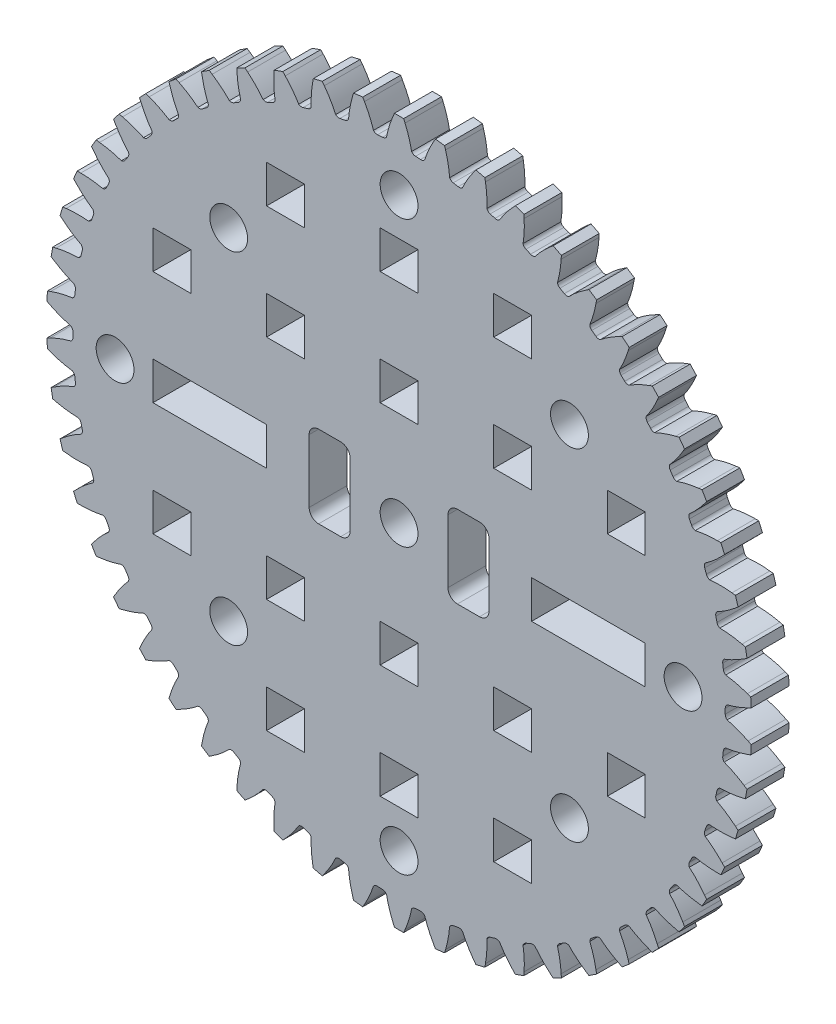
from build123d import *

# Parameters (mm, degrees)
MODEL_R                 = 1.5
MODEL_W                 = 3
MODEL_H                 = 3
MODEL_W_2               = 9
SALIENTE_EXTRUIR1_DEPTH = 3


with BuildPart() as part:
    # Model → Saliente-Extruir1 (new body)
    with BuildSketch(Plane.XY):
        with BuildLine():
            Line((42.666112534, 293.118679828), (42.831818554, 293.341758876))
            Line((42.831818554, 293.341758876), (43.541383546, 293.173588883))
            Line((43.541383546, 293.173588883), (43.58934616, 292.89986944))
            ThreePointArc((43.58934616, 292.89986944), (43.695378697, 292.019957383), (43.707036734, 291.13375638))
            ThreePointArc((43.707036734, 291.13375638), (43.808559511, 290.98396211), (43.967022143, 290.896584814))
            Line((43.967022143, 290.896584814), (44.348377912, 290.782414391))
            ThreePointArc((44.348377912, 290.782414391), (44.528786118, 290.768340418), (44.695920457, 290.837704028))
            ThreePointArc((44.695920457, 290.837704028), (45.192636012, 291.571707968), (45.76474448, 292.248597936))
            Line((45.76474448, 292.248597936), (45.955227951, 292.450931307))
            Line((45.955227951, 292.450931307), (46.640471774, 292.201522952))
            Line((46.640471774, 292.201522952), (46.656333194, 291.924086182))
            ThreePointArc((46.656333194, 291.924086182), (46.659497223, 291.03781415), (46.568194775, 290.156251906))
            ThreePointArc((46.568194775, 290.156251906), (46.651641038, 289.995684416), (46.798888317, 289.890501545))
            Line((46.798888317, 289.890501545), (47.164411118, 289.7328304))
            ThreePointArc((47.164411118, 289.7328304), (47.34196558, 289.697907475), (47.51602244, 289.74739896))
            ThreePointArc((47.51602244, 289.74739896), (48.094592038, 290.418774672), (48.741414242, 291.024670013))
            Line((48.741414242, 291.024670013), (48.954099203, 291.203521497))
            Line((48.954099203, 291.203521497), (49.60575511, 290.8762476))
            Line((49.60575511, 290.8762476), (49.589300838, 290.59884536))
            ThreePointArc((49.589300838, 290.59884536), (49.489553569, 289.71819866), (49.296525346, 288.853196792))
            ThreePointArc((49.296525346, 288.853196792), (49.360766627, 288.684027482), (49.494807287, 288.562461455))
            Line((49.494807287, 288.562461455), (49.83955405, 288.363421818))
            ThreePointArc((49.83955405, 288.363421818), (50.011853649, 288.308122215), (50.190479209, 288.337072288))
            ThreePointArc((50.190479209, 288.337072288), (50.84307869, 288.936740567), (51.555867469, 289.463447586))
            Line((51.555867469, 289.463447586), (51.78787772, 289.616398524))
            Line((51.78787772, 289.616398524), (52.397133183, 289.215684902))
            Line((52.397133183, 289.215684902), (52.348585734, 288.942068581))
            ThreePointArc((52.348585734, 288.942068581), (52.147276079, 288.07895645), (51.855132456, 287.242212624))
            ThreePointArc((51.855132456, 287.242212624), (51.899300002, 287.066729219), (52.018321373, 286.930424007))
            Line((52.018321373, 286.930424007), (52.337629991, 286.692707549))
            ThreePointArc((52.337629991, 286.692707549), (52.502344669, 286.617779099), (52.683123325, 286.625796261))
            ThreePointArc((52.683123325, 286.625796261), (53.4009274, 287.145647622), (54.170043509, 287.586043509))
            Line((54.170043509, 287.586043509), (54.41824151, 287.711025502))
            Line((54.41824151, 287.711025502), (54.976857393, 287.24229112))
            Line((54.976857393, 287.24229112), (54.896873289, 286.97616091))
            ThreePointArc((54.896873289, 286.97616091), (54.596723615, 286.142255459), (54.209415334, 285.3450852))
            ThreePointArc((54.209415334, 285.3450852), (54.232911855, 285.165660812), (54.335304377, 285.016459709))
            Line((54.335304377, 285.016459709), (54.624856747, 284.743281136))
            ThreePointArc((54.624856747, 284.743281136), (54.779759021, 284.649737119), (54.960246053, 284.63671295))
            ThreePointArc((54.960246053, 284.63671295), (55.733547653, 285.069717296), (56.548590116, 285.417846453))
            Line((56.548590116, 285.417846453), (56.809619414, 285.513169333))
            Line((56.809619414, 285.513169333), (57.310041396, 284.98275302))
            Line((57.310041396, 284.98275302), (57.199702284, 284.727707874))
            ThreePointArc((57.199702284, 284.727707874), (56.804771601, 283.934286244), (56.327536341, 283.187469912))
            ThreePointArc((56.327536341, 283.187469912), (56.330044088, 283.006530948), (56.414423077, 282.846451643))
            Line((56.414423077, 282.846451643), (56.670303501, 282.541505228))
            ThreePointArc((56.670303501, 282.541505228), (56.813298584, 282.430610666), (56.991053213, 282.396721296))
            ThreePointArc((56.991053213, 282.396721296), (57.80939476, 282.737022985), (58.659341526, 282.988177563))
            Line((58.659341526, 282.988177563), (58.929672149, 283.052552252))
            Line((58.929672149, 283.052552252), (59.365132881, 282.467626978))
            Line((59.365132881, 282.467626978), (59.225930908, 282.227115945))
            ThreePointArc((59.225930908, 282.227115945), (58.741559977, 281.484907802), (58.180851526, 280.798544807))
            ThreePointArc((58.180851526, 280.798544807), (58.162336585, 280.618538156), (58.22756096, 280.449745447))
            Line((58.22756096, 280.449745447), (58.446309095, 280.117155067))
            ThreePointArc((58.446309095, 280.117155067), (58.575463223, 279.990409618), (58.748081624, 279.936113343))
            ThreePointArc((58.748081624, 279.936113343), (59.600396452, 280.179110379), (60.473753449, 280.329893942))
            Line((60.473753449, 280.329893942), (60.749729638, 280.362449883))
            Line((60.749729638, 280.362449883), (61.114340261, 279.730925759))
            Line((61.114340261, 279.730925759), (60.948157896, 279.508201338))
            ThreePointArc((60.948157896, 279.508201338), (60.380897, 278.827243774), (59.74429798, 278.210615998))
            ThreePointArc((59.74429798, 278.210615998), (59.705010733, 278.033975941), (59.750198447, 277.85875246))
            Line((59.750198447, 277.85875246), (59.928856099, 277.503015829))
            ThreePointArc((59.928856099, 277.503015829), (60.042422684, 277.362133508), (60.207570488, 277.288164592))
            ThreePointArc((60.207570488, 277.288164592), (61.082332503, 277.430570857), (61.967289076, 277.478944317))
            Line((61.967289076, 277.478944317), (62.245178727, 277.479241246))
            Line((62.245178727, 277.479241246), (62.534008507, 276.809658552))
            Line((62.534008507, 276.809658552), (62.34309308, 276.60773271))
            ThreePointArc((62.34309308, 276.60773271), (61.700613452, 275.997234508), (60.996732771, 275.458680783))
            ThreePointArc((60.996732771, 275.458680783), (60.937204511, 275.287796074), (60.961744478, 275.108511419))
            Line((60.961744478, 275.108511419), (61.097895608, 274.734439263))
            ThreePointArc((61.097895608, 274.734439263), (61.194338858, 274.581325263), (61.349782725, 274.488684008))
            ThreePointArc((61.349782725, 274.488684008), (62.23516227, 274.528573701), (63.119750899, 274.47388289))
            Line((63.119750899, 274.47388289), (63.39579603, 274.441916791))
            Line((63.39579603, 274.441916791), (63.604939041, 273.743330486))
            Line((63.604939041, 273.743330486), (63.391872356, 273.564933922))
            ThreePointArc((63.391872356, 273.564933922), (62.682862431, 273.033151022), (61.921218868, 272.579954365))
            ThreePointArc((61.921218868, 272.579954365), (61.842254613, 272.417135926), (61.845814971, 272.236214613))
            Line((61.845814971, 272.236214613), (61.937618369, 271.848865619))
            ThreePointArc((61.937618369, 271.848865619), (62.015634054, 271.685590542), (62.159271871, 271.575529763))
            ThreePointArc((62.159271871, 271.575529763), (63.043295708, 271.512363445), (63.915553849, 271.355347962))
            Line((63.915553849, 271.355347962), (64.186021424, 271.291551123))
            Line((64.186021424, 271.291551123), (64.312649365, 270.573408386))
            Line((64.312649365, 270.573408386), (64.080312784, 270.420953608))
            ThreePointArc((64.080312784, 270.420953608), (63.314360703, 269.975077463), (62.505254181, 269.61336658))
            ThreePointArc((62.505254181, 269.61336658), (62.407921787, 269.460816252), (62.390454389, 269.280704932))
            Line((62.390454389, 269.280704932), (62.436668572, 268.885317328))
            ThreePointArc((62.436668572, 268.885317328), (62.495201663, 268.714089191), (62.625090976, 268.588097272))
            ThreePointArc((62.625090976, 268.588097272), (63.495804198, 268.422729158), (64.343936056, 268.165512368))
            Line((64.343936056, 268.165512368), (64.605168466, 268.070747531))
            Line((64.605168466, 268.070747531), (64.647568911, 267.342760012))
            Line((64.647568911, 267.342760012), (64.399104387, 267.21830871))
            ThreePointArc((64.399104387, 267.21830871), (63.586568339, 266.864369028), (62.740940636, 266.599035439))
            ThreePointArc((62.740940636, 266.599035439), (62.626556356, 266.458816203), (62.588297418, 266.281950572))
            Line((62.588297418, 266.281950572), (62.588297418, 265.883871299))
            ThreePointArc((62.588297418, 265.883871299), (62.626556356, 265.707005668), (62.740940636, 265.566786432))
            ThreePointArc((62.740940636, 265.566786432), (63.586568339, 265.301452843), (64.399104387, 264.947513162))
            Line((64.399104387, 264.947513162), (64.647568911, 264.823061859))
            Line((64.647568911, 264.823061859), (64.605168466, 264.09507434))
            Line((64.605168466, 264.09507434), (64.343936056, 264.000309504))
            ThreePointArc((64.343936056, 264.000309504), (63.495804198, 263.743092714), (62.625090976, 263.5777246))
            ThreePointArc((62.625090976, 263.5777246), (62.495201663, 263.45173268), (62.436668572, 263.280504543))
            Line((62.436668572, 263.280504543), (62.390454389, 262.885116939))
            ThreePointArc((62.390454389, 262.885116939), (62.407921787, 262.705005619), (62.505254181, 262.552455291))
            ThreePointArc((62.505254181, 262.552455291), (63.314360703, 262.190744408), (64.080312784, 261.744868263))
            Line((64.080312784, 261.744868263), (64.312649365, 261.592413485))
            Line((64.312649365, 261.592413485), (64.186021424, 260.874270749))
            Line((64.186021424, 260.874270749), (63.915553849, 260.810473909))
            ThreePointArc((63.915553849, 260.810473909), (63.043295708, 260.653458426), (62.159271871, 260.590292108))
            ThreePointArc((62.159271871, 260.590292108), (62.015634054, 260.480231329), (61.937618369, 260.316956253))
            Line((61.937618369, 260.316956253), (61.845814971, 259.929607258))
            ThreePointArc((61.845814971, 259.929607258), (61.842254613, 259.748685945), (61.921218868, 259.585867506))
            ThreePointArc((61.921218868, 259.585867506), (62.682862431, 259.132670849), (63.391872356, 258.600887949))
            Line((63.391872356, 258.600887949), (63.604939041, 258.422491385))
            Line((63.604939041, 258.422491385), (63.39579603, 257.72390508))
            Line((63.39579603, 257.72390508), (63.119750899, 257.691938981))
            ThreePointArc((63.119750899, 257.691938981), (62.23516227, 257.63724817), (61.349782725, 257.677137863))
            ThreePointArc((61.349782725, 257.677137863), (61.194338858, 257.584496609), (61.097895608, 257.431382608))
            Line((61.097895608, 257.431382608), (60.961744478, 257.057310453))
            ThreePointArc((60.961744478, 257.057310453), (60.937204511, 256.878025797), (60.996732771, 256.707141088))
            ThreePointArc((60.996732771, 256.707141088), (61.700613452, 256.168587364), (62.34309308, 255.558089162))
            Line((62.34309308, 255.558089162), (62.534008507, 255.356163319))
            Line((62.534008507, 255.356163319), (62.245178727, 254.686580626))
            Line((62.245178727, 254.686580626), (61.967289076, 254.686877554))
            ThreePointArc((61.967289076, 254.686877554), (61.082332503, 254.735251015), (60.207570488, 254.877657279))
            ThreePointArc((60.207570488, 254.877657279), (60.042422684, 254.803688363), (59.928856099, 254.662806043))
            Line((59.928856099, 254.662806043), (59.750198447, 254.307069411))
            ThreePointArc((59.750198447, 254.307069411), (59.705010733, 254.13184593), (59.74429798, 253.955205873))
            ThreePointArc((59.74429798, 253.955205873), (60.380897, 253.338578097), (60.948157896, 252.657620533))
            Line((60.948157896, 252.657620533), (61.114340261, 252.434896112))
            Line((61.114340261, 252.434896112), (60.749729638, 251.803371989))
            Line((60.749729638, 251.803371989), (60.473753449, 251.835927929))
            ThreePointArc((60.473753449, 251.835927929), (59.600396453, 251.986711493), (58.748081624, 252.229708528))
            ThreePointArc((58.748081624, 252.229708528), (58.575463223, 252.175412254), (58.446309095, 252.048666805))
            Line((58.446309095, 252.048666805), (58.22756096, 251.716076424))
            ThreePointArc((58.22756096, 251.716076424), (58.162336585, 251.547283716), (58.180851526, 251.367277064))
            ThreePointArc((58.180851526, 251.367277064), (58.741559977, 250.680914069), (59.225930908, 249.938705926))
            Line((59.225930908, 249.938705926), (59.365132881, 249.698194893))
            Line((59.365132881, 249.698194893), (58.929672149, 249.11326962))
            Line((58.929672149, 249.11326962), (58.659341526, 249.177644308))
            ThreePointArc((58.659341526, 249.177644308), (57.80939476, 249.428798886), (56.991053213, 249.769100575))
            ThreePointArc((56.991053213, 249.769100575), (56.813298584, 249.735211206), (56.670303501, 249.624316643))
            Line((56.670303501, 249.624316643), (56.414423077, 249.319370228))
            ThreePointArc((56.414423077, 249.319370228), (56.330044088, 249.159290924), (56.327536341, 248.978351959))
            ThreePointArc((56.327536341, 248.978351959), (56.804771601, 248.231535627), (57.199702284, 247.438113997))
            Line((57.199702284, 247.438113997), (57.310041396, 247.183068851))
            Line((57.310041396, 247.183068851), (56.809619414, 246.652652538))
            Line((56.809619414, 246.652652538), (56.548590116, 246.747975418))
            ThreePointArc((56.548590116, 246.747975418), (55.733547653, 247.096104575), (54.960246053, 247.529108921))
            ThreePointArc((54.960246053, 247.529108921), (54.779759021, 247.516084752), (54.624856747, 247.422540735))
            Line((54.624856747, 247.422540735), (54.335304377, 247.149362163))
            ThreePointArc((54.335304377, 247.149362163), (54.232911855, 247.00016106), (54.209415333, 246.820736671))
            ThreePointArc((54.209415333, 246.820736671), (54.596723615, 246.023566412), (54.896873289, 245.189660962))
            Line((54.896873289, 245.189660962), (54.976857393, 244.923530751))
            Line((54.976857393, 244.923530751), (54.41824151, 244.45479637))
            Line((54.41824151, 244.45479637), (54.170043509, 244.579778362))
            ThreePointArc((54.170043509, 244.579778362), (53.4009274, 245.020174249), (52.683123326, 245.540025611))
            ThreePointArc((52.683123326, 245.540025611), (52.502344669, 245.548042772), (52.337629991, 245.473114323))
            Line((52.337629991, 245.473114323), (52.018321373, 245.235397864))
            ThreePointArc((52.018321373, 245.235397864), (51.899300002, 245.099092652), (51.855132456, 244.923609247))
            ThreePointArc((51.855132456, 244.923609247), (52.147276079, 244.086865421), (52.348585734, 243.22375329))
            Line((52.348585734, 243.22375329), (52.397133183, 242.950136969))
            Line((52.397133183, 242.950136969), (51.78787772, 242.549423348))
            Line((51.78787772, 242.549423348), (51.555867469, 242.702374286))
            ThreePointArc((51.555867469, 242.702374286), (50.84307869, 243.229081304), (50.190479209, 243.828749583))
            ThreePointArc((50.190479209, 243.828749583), (50.011853649, 243.857699656), (49.83955405, 243.802400053))
            Line((49.83955405, 243.802400053), (49.494807287, 243.603360417))
            ThreePointArc((49.494807287, 243.603360417), (49.360766627, 243.481794389), (49.296525346, 243.312625079))
            ThreePointArc((49.296525346, 243.312625079), (49.489553569, 242.447623211), (49.589300838, 241.566976512))
            Line((49.589300838, 241.566976512), (49.60575511, 241.289574271))
            Line((49.60575511, 241.289574271), (48.954099203, 240.962300374))
            Line((48.954099203, 240.962300374), (48.741414242, 241.141151858))
            ThreePointArc((48.741414242, 241.141151858), (48.094592038, 241.747047199), (47.51602244, 242.418422911))
            ThreePointArc((47.51602244, 242.418422911), (47.34196558, 242.467914396), (47.164411118, 242.432991472))
            Line((47.164411118, 242.432991472), (46.798888317, 242.275320326))
            ThreePointArc((46.798888317, 242.275320326), (46.651641038, 242.170137456), (46.568194775, 242.009569966))
            ThreePointArc((46.568194775, 242.009569966), (46.659497223, 241.128007722), (46.656333194, 240.241735689))
            Line((46.656333194, 240.241735689), (46.640471774, 239.964298919))
            Line((46.640471774, 239.964298919), (45.955227951, 239.714890564))
            Line((45.955227951, 239.714890564), (45.76474448, 239.917223936))
            ThreePointArc((45.76474448, 239.917223936), (45.192636012, 240.594113903), (44.695920457, 241.328117844))
            ThreePointArc((44.695920457, 241.328117844), (44.528786118, 241.397481453), (44.348377912, 241.38340748))
            Line((44.348377912, 241.38340748), (43.967022143, 241.269237057))
            ThreePointArc((43.967022143, 241.269237057), (43.808559511, 241.181859762), (43.707036734, 241.032065491))
            ThreePointArc((43.707036734, 241.032065491), (43.695378697, 240.145864489), (43.58934616, 239.265952432))
            Line((43.58934616, 239.265952432), (43.541383546, 238.992232988))
            Line((43.541383546, 238.992232988), (42.831818554, 238.824062996))
            Line((42.831818554, 238.824062996), (42.666112534, 239.047142043))
            ThreePointArc((42.666112534, 239.047142043), (42.176454588, 239.785872862), (41.768310303, 240.572578886))
            ThreePointArc((41.768310303, 240.572578886), (41.61035869, 240.660876597), (41.429536451, 240.667841901))
            Line((41.429536451, 240.667841901), (41.037504896, 240.59871616))
            ThreePointArc((41.037504896, 240.59871616), (40.869969847, 240.530326067), (40.751743477, 240.393330727))
            ThreePointArc((40.751743477, 240.393330727), (40.637282611, 239.514475314), (40.429815473, 238.652822534))
            Line((40.429815473, 238.652822534), (40.350400277, 238.386522003))
            Line((40.350400277, 238.386522003), (39.626109765, 238.301864584))
            Line((39.626109765, 238.301864584), (39.487422087, 238.542672545))
            ThreePointArc((39.487422087, 238.542672545), (39.086836446, 239.333254148), (38.772782881, 240.162023407))
            ThreePointArc((38.772782881, 240.162023407), (38.626150019, 240.268061143), (38.447359058, 240.295971531))
            Line((38.447359058, 240.295971531), (38.049953272, 240.27282528))
            ThreePointArc((38.049953272, 240.27282528), (37.875611429, 240.224347248), (37.742280276, 240.102003465))
            ThreePointArc((37.742280276, 240.102003465), (37.526564467, 239.242378654), (37.220468365, 238.410637526))
            Line((37.220468365, 238.410637526), (37.110674542, 238.155357166))
            Line((37.110674542, 238.155357166), (36.381453297, 238.155357166))
            Line((36.381453297, 238.155357166), (36.271659473, 238.410637526))
            ThreePointArc((36.271659473, 238.410637526), (35.965563371, 239.242378654), (35.749847563, 240.102003466))
            ThreePointArc((35.749847563, 240.102003466), (35.616516409, 240.224347248), (35.442174567, 240.27282528))
            Line((35.442174567, 240.27282528), (35.044768781, 240.295971531))
            ThreePointArc((35.044768781, 240.295971531), (34.865977819, 240.268061143), (34.719344957, 240.162023407))
            ThreePointArc((34.719344957, 240.162023407), (34.405291393, 239.333254148), (34.004705752, 238.542672545))
            Line((34.004705752, 238.542672545), (33.866018074, 238.301864584))
            Line((33.866018074, 238.301864584), (33.141727562, 238.386522003))
            Line((33.141727562, 238.386522003), (33.062312366, 238.652822534))
            ThreePointArc((33.062312366, 238.652822534), (32.854845228, 239.514475314), (32.740384362, 240.393330727))
            ThreePointArc((32.740384362, 240.393330727), (32.622157992, 240.530326067), (32.454622943, 240.59871616))
            Line((32.454622943, 240.59871616), (32.062591388, 240.667841901))
            ThreePointArc((32.062591388, 240.667841901), (31.881769149, 240.660876597), (31.723817536, 240.572578886))
            ThreePointArc((31.723817536, 240.572578886), (31.315673251, 239.785872862), (30.826015305, 239.047142043))
            Line((30.826015305, 239.047142043), (30.660309285, 238.824062996))
            Line((30.660309285, 238.824062996), (29.950744293, 238.992232988))
            Line((29.950744293, 238.992232988), (29.902781679, 239.265952432))
            ThreePointArc((29.902781679, 239.265952432), (29.796749141, 240.145864489), (29.785091105, 241.032065491))
            ThreePointArc((29.785091105, 241.032065491), (29.683568328, 241.181859762), (29.525105696, 241.269237057))
            Line((29.525105696, 241.269237057), (29.143749927, 241.38340748))
            ThreePointArc((29.143749927, 241.38340748), (28.963341721, 241.397481453), (28.796207382, 241.328117844))
            ThreePointArc((28.796207382, 241.328117844), (28.299491827, 240.594113903), (27.727383359, 239.917223936))
            Line((27.727383359, 239.917223936), (27.536899888, 239.714890564))
            Line((27.536899888, 239.714890564), (26.851656065, 239.964298919))
            Line((26.851656065, 239.964298919), (26.835794644, 240.241735689))
            ThreePointArc((26.835794644, 240.241735689), (26.832630616, 241.128007722), (26.923933064, 242.009569966))
            ThreePointArc((26.923933064, 242.009569966), (26.840486801, 242.170137456), (26.693239521, 242.275320326))
            Line((26.693239521, 242.275320326), (26.327716721, 242.432991472))
            ThreePointArc((26.327716721, 242.432991472), (26.150162259, 242.467914396), (25.976105399, 242.418422911))
            ThreePointArc((25.976105399, 242.418422911), (25.397535801, 241.747047199), (24.750713597, 241.141151858))
            Line((24.750713597, 241.141151858), (24.538028636, 240.962300374))
            Line((24.538028636, 240.962300374), (23.886372729, 241.289574271))
            Line((23.886372729, 241.289574271), (23.902827001, 241.566976512))
            ThreePointArc((23.902827001, 241.566976512), (24.00257427, 242.447623211), (24.195602493, 243.312625079))
            ThreePointArc((24.195602493, 243.312625079), (24.131361212, 243.481794389), (23.997320551, 243.603360417))
            Line((23.997320551, 243.603360417), (23.652573788, 243.802400053))
            ThreePointArc((23.652573788, 243.802400053), (23.48027419, 243.857699656), (23.301648629, 243.828749583))
            ThreePointArc((23.301648629, 243.828749583), (22.649049149, 243.229081304), (21.93626037, 242.702374286))
            Line((21.93626037, 242.702374286), (21.704250118, 242.549423348))
            Line((21.704250118, 242.549423348), (21.094994656, 242.950136969))
            Line((21.094994656, 242.950136969), (21.143542105, 243.22375329))
            ThreePointArc((21.143542105, 243.22375329), (21.34485176, 244.086865421), (21.636995383, 244.923609247))
            ThreePointArc((21.636995383, 244.923609247), (21.592827836, 245.099092652), (21.473806465, 245.235397864))
            Line((21.473806465, 245.235397864), (21.154497848, 245.473114323))
            ThreePointArc((21.154497848, 245.473114323), (20.98978317, 245.548042772), (20.809004513, 245.540025611))
            ThreePointArc((20.809004513, 245.540025611), (20.091200439, 245.020174249), (19.32208433, 244.579778362))
            Line((19.32208433, 244.579778362), (19.073886328, 244.45479637))
            Line((19.073886328, 244.45479637), (18.515270446, 244.923530751))
            Line((18.515270446, 244.923530751), (18.59525455, 245.189660962))
            ThreePointArc((18.59525455, 245.189660962), (18.895404223, 246.023566412), (19.282712505, 246.820736671))
            ThreePointArc((19.282712505, 246.820736671), (19.259215984, 247.00016106), (19.156823462, 247.149362163))
            Line((19.156823462, 247.149362163), (18.867271091, 247.422540735))
            ThreePointArc((18.867271091, 247.422540735), (18.712368817, 247.516084752), (18.531881786, 247.529108921))
            ThreePointArc((18.531881786, 247.529108921), (17.758580186, 247.096104575), (16.943537723, 246.747975418))
            Line((16.943537723, 246.747975418), (16.682508424, 246.652652538))
            Line((16.682508424, 246.652652538), (16.182086442, 247.183068851))
            Line((16.182086442, 247.183068851), (16.292425555, 247.438113997))
            ThreePointArc((16.292425555, 247.438113997), (16.687356237, 248.231535627), (17.164591497, 248.978351959))
            ThreePointArc((17.164591497, 248.978351959), (17.162083751, 249.159290924), (17.077704762, 249.319370228))
            Line((17.077704762, 249.319370228), (16.821824337, 249.624316643))
            ThreePointArc((16.821824337, 249.624316643), (16.678829255, 249.735211206), (16.501074625, 249.769100575))
            ThreePointArc((16.501074625, 249.769100575), (15.682733078, 249.428798886), (14.832786312, 249.177644308))
            Line((14.832786312, 249.177644308), (14.562455689, 249.11326962))
            Line((14.562455689, 249.11326962), (14.126994957, 249.698194893))
            Line((14.126994957, 249.698194893), (14.26619693, 249.938705926))
            ThreePointArc((14.26619693, 249.938705926), (14.750567862, 250.680914069), (15.311276312, 251.367277064))
            ThreePointArc((15.311276312, 251.367277064), (15.329791254, 251.547283716), (15.264566878, 251.716076424))
            Line((15.264566878, 251.716076424), (15.045818744, 252.048666805))
            ThreePointArc((15.045818744, 252.048666805), (14.916664616, 252.175412254), (14.744046215, 252.229708528))
            ThreePointArc((14.744046215, 252.229708528), (13.891731386, 251.986711492), (13.018374389, 251.835927929))
            Line((13.018374389, 251.835927929), (12.7423982, 251.803371989))
            Line((12.7423982, 251.803371989), (12.377787578, 252.434896112))
            Line((12.377787578, 252.434896112), (12.543969943, 252.657620533))
            ThreePointArc((12.543969943, 252.657620533), (13.111230838, 253.338578097), (13.747829859, 253.955205873))
            ThreePointArc((13.747829859, 253.955205873), (13.787117106, 254.13184593), (13.741929391, 254.307069411))
            Line((13.741929391, 254.307069411), (13.56327174, 254.662806043))
            ThreePointArc((13.56327174, 254.662806043), (13.449705154, 254.803688363), (13.28455735, 254.877657279))
            ThreePointArc((13.28455735, 254.877657279), (12.409795335, 254.735251015), (11.524838763, 254.686877554))
            Line((11.524838763, 254.686877554), (11.246949112, 254.686580626))
            Line((11.246949112, 254.686580626), (10.958119332, 255.356163319))
            Line((10.958119332, 255.356163319), (11.149034759, 255.558089162))
            ThreePointArc((11.149034759, 255.558089162), (11.791514386, 256.168587364), (12.495395067, 256.707141088))
            ThreePointArc((12.495395067, 256.707141088), (12.554923327, 256.878025797), (12.530383361, 257.057310453))
            Line((12.530383361, 257.057310453), (12.394232231, 257.431382608))
            ThreePointArc((12.394232231, 257.431382608), (12.297788981, 257.584496609), (12.142345114, 257.677137863))
            ThreePointArc((12.142345114, 257.677137863), (11.256965569, 257.63724817), (10.37237694, 257.691938981))
            Line((10.37237694, 257.691938981), (10.096331808, 257.72390508))
            Line((10.096331808, 257.72390508), (9.887188798, 258.422491385))
            Line((9.887188798, 258.422491385), (10.100255482, 258.600887949))
            ThreePointArc((10.100255482, 258.600887949), (10.809265408, 259.132670849), (11.570908971, 259.585867506))
            ThreePointArc((11.570908971, 259.585867506), (11.649873226, 259.748685945), (11.646312868, 259.929607258))
            Line((11.646312868, 259.929607258), (11.55450947, 260.316956253))
            ThreePointArc((11.55450947, 260.316956253), (11.476493785, 260.480231329), (11.332855967, 260.590292108))
            ThreePointArc((11.332855967, 260.590292108), (10.448832131, 260.653458426), (9.57657399, 260.810473909))
            Line((9.57657399, 260.810473909), (9.306106414, 260.874270749))
            Line((9.306106414, 260.874270749), (9.179478474, 261.592413485))
            Line((9.179478474, 261.592413485), (9.411815055, 261.744868263))
            ThreePointArc((9.411815055, 261.744868263), (10.177767135, 262.190744408), (10.986873658, 262.552455291))
            ThreePointArc((10.986873658, 262.552455291), (11.084206052, 262.705005619), (11.10167345, 262.885116939))
            Line((11.10167345, 262.885116939), (11.055459267, 263.280504543))
            ThreePointArc((11.055459267, 263.280504543), (10.996926176, 263.45173268), (10.867036862, 263.5777246))
            ThreePointArc((10.867036862, 263.5777246), (9.996323641, 263.743092714), (9.148191782, 264.000309504))
            Line((9.148191782, 264.000309504), (8.886959372, 264.09507434))
            Line((8.886959372, 264.09507434), (8.844558928, 264.823061859))
            Line((8.844558928, 264.823061859), (9.093023451, 264.947513162))
            ThreePointArc((9.093023451, 264.947513162), (9.905559499, 265.301452843), (10.751187203, 265.566786432))
            ThreePointArc((10.751187203, 265.566786432), (10.865571482, 265.707005668), (10.90383042, 265.883871299))
            Line((10.90383042, 265.883871299), (10.90383042, 266.281950572))
            ThreePointArc((10.90383042, 266.281950572), (10.865571482, 266.458816203), (10.751187203, 266.599035439))
            ThreePointArc((10.751187203, 266.599035439), (9.905559499, 266.864369028), (9.093023451, 267.21830871))
            Line((9.093023451, 267.21830871), (8.844558928, 267.342760012))
            Line((8.844558928, 267.342760012), (8.886959372, 268.070747531))
            Line((8.886959372, 268.070747531), (9.148191782, 268.165512368))
            ThreePointArc((9.148191782, 268.165512368), (9.996323641, 268.422729158), (10.867036862, 268.588097271))
            ThreePointArc((10.867036862, 268.588097271), (10.996926176, 268.714089191), (11.055459267, 268.885317328))
            Line((11.055459267, 268.885317328), (11.10167345, 269.280704932))
            ThreePointArc((11.10167345, 269.280704932), (11.084206052, 269.460816252), (10.986873658, 269.61336658))
            ThreePointArc((10.986873658, 269.61336658), (10.177767135, 269.975077463), (9.411815055, 270.420953608))
            Line((9.411815055, 270.420953608), (9.179478474, 270.573408386))
            Line((9.179478474, 270.573408386), (9.306106414, 271.291551123))
            Line((9.306106414, 271.291551123), (9.57657399, 271.355347962))
            ThreePointArc((9.57657399, 271.355347962), (10.448832131, 271.512363445), (11.332855967, 271.575529763))
            ThreePointArc((11.332855967, 271.575529763), (11.476493785, 271.685590542), (11.55450947, 271.848865619))
            Line((11.55450947, 271.848865619), (11.646312868, 272.236214613))
            ThreePointArc((11.646312868, 272.236214613), (11.649873226, 272.417135926), (11.570908971, 272.579954365))
            ThreePointArc((11.570908971, 272.579954365), (10.809265408, 273.033151022), (10.100255482, 273.564933922))
            Line((10.100255482, 273.564933922), (9.887188798, 273.743330486))
            Line((9.887188798, 273.743330486), (10.096331808, 274.441916791))
            Line((10.096331808, 274.441916791), (10.37237694, 274.47388289))
            ThreePointArc((10.37237694, 274.47388289), (11.256965569, 274.528573701), (12.142345114, 274.488684008))
            ThreePointArc((12.142345114, 274.488684008), (12.297788981, 274.581325263), (12.394232231, 274.734439263))
            Line((12.394232231, 274.734439263), (12.530383361, 275.108511419))
            ThreePointArc((12.530383361, 275.108511419), (12.554923327, 275.287796074), (12.495395067, 275.458680783))
            ThreePointArc((12.495395067, 275.458680783), (11.791514386, 275.997234508), (11.149034759, 276.60773271))
            Line((11.149034759, 276.60773271), (10.958119332, 276.809658552))
            Line((10.958119332, 276.809658552), (11.246949112, 277.479241246))
            Line((11.246949112, 277.479241246), (11.524838763, 277.478944317))
            ThreePointArc((11.524838763, 277.478944317), (12.409795335, 277.430570857), (13.28455735, 277.288164592))
            ThreePointArc((13.28455735, 277.288164592), (13.449705154, 277.362133508), (13.56327174, 277.503015829))
            Line((13.56327174, 277.503015829), (13.741929391, 277.85875246))
            ThreePointArc((13.741929391, 277.85875246), (13.787117106, 278.033975941), (13.747829859, 278.210615998))
            ThreePointArc((13.747829859, 278.210615998), (13.111230838, 278.827243774), (12.543969943, 279.508201338))
            Line((12.543969943, 279.508201338), (12.377787578, 279.730925759))
            Line((12.377787578, 279.730925759), (12.7423982, 280.362449883))
            Line((12.7423982, 280.362449883), (13.018374389, 280.329893942))
            ThreePointArc((13.018374389, 280.329893942), (13.891731386, 280.179110379), (14.744046215, 279.936113343))
            ThreePointArc((14.744046215, 279.936113343), (14.916664616, 279.990409618), (15.045818744, 280.117155067))
            Line((15.045818744, 280.117155067), (15.264566878, 280.449745447))
            ThreePointArc((15.264566878, 280.449745447), (15.329791254, 280.618538156), (15.311276312, 280.798544807))
            ThreePointArc((15.311276312, 280.798544807), (14.750567862, 281.484907802), (14.26619693, 282.227115945))
            Line((14.26619693, 282.227115945), (14.126994957, 282.467626978))
            Line((14.126994957, 282.467626978), (14.562455689, 283.052552252))
            Line((14.562455689, 283.052552252), (14.832786312, 282.988177563))
            ThreePointArc((14.832786312, 282.988177563), (15.682733078, 282.737022985), (16.501074625, 282.396721296))
            ThreePointArc((16.501074625, 282.396721296), (16.678829255, 282.430610666), (16.821824337, 282.541505228))
            Line((16.821824337, 282.541505228), (17.077704762, 282.846451643))
            ThreePointArc((17.077704762, 282.846451643), (17.162083751, 283.006530948), (17.164591497, 283.187469912))
            ThreePointArc((17.164591497, 283.187469912), (16.687356237, 283.934286244), (16.292425555, 284.727707874))
            Line((16.292425555, 284.727707874), (16.182086442, 284.98275302))
            Line((16.182086442, 284.98275302), (16.682508424, 285.513169333))
            Line((16.682508424, 285.513169333), (16.943537723, 285.417846453))
            ThreePointArc((16.943537723, 285.417846453), (17.758580186, 285.069717296), (18.531881785, 284.63671295))
            ThreePointArc((18.531881785, 284.63671295), (18.712368817, 284.649737119), (18.867271091, 284.743281136))
            Line((18.867271091, 284.743281136), (19.156823462, 285.016459709))
            ThreePointArc((19.156823462, 285.016459709), (19.259215984, 285.165660812), (19.282712505, 285.3450852))
            ThreePointArc((19.282712505, 285.3450852), (18.895404224, 286.142255459), (18.59525455, 286.97616091))
            Line((18.59525455, 286.97616091), (18.515270446, 287.24229112))
            Line((18.515270446, 287.24229112), (19.073886328, 287.711025502))
            Line((19.073886328, 287.711025502), (19.32208433, 287.586043509))
            ThreePointArc((19.32208433, 287.586043509), (20.091200439, 287.145647622), (20.809004513, 286.625796261))
            ThreePointArc((20.809004513, 286.625796261), (20.98978317, 286.617779099), (21.154497848, 286.692707549))
            Line((21.154497848, 286.692707549), (21.473806465, 286.930424007))
            ThreePointArc((21.473806465, 286.930424007), (21.592827836, 287.066729219), (21.636995383, 287.242212624))
            ThreePointArc((21.636995383, 287.242212624), (21.34485176, 288.07895645), (21.143542105, 288.942068581))
            Line((21.143542105, 288.942068581), (21.094994656, 289.215684902))
            Line((21.094994656, 289.215684902), (21.704250118, 289.616398524))
            Line((21.704250118, 289.616398524), (21.93626037, 289.463447586))
            ThreePointArc((21.93626037, 289.463447586), (22.649049149, 288.936740567), (23.301648629, 288.337072288))
            ThreePointArc((23.301648629, 288.337072288), (23.48027419, 288.308122215), (23.652573788, 288.363421818))
            Line((23.652573788, 288.363421818), (23.997320551, 288.562461455))
            ThreePointArc((23.997320551, 288.562461455), (24.131361212, 288.684027482), (24.195602493, 288.853196792))
            ThreePointArc((24.195602493, 288.853196792), (24.00257427, 289.71819866), (23.902827001, 290.59884536))
            Line((23.902827001, 290.59884536), (23.886372729, 290.8762476))
            Line((23.886372729, 290.8762476), (24.538028636, 291.203521497))
            Line((24.538028636, 291.203521497), (24.750713597, 291.024670013))
            ThreePointArc((24.750713597, 291.024670013), (25.397535801, 290.418774672), (25.976105399, 289.74739896))
            ThreePointArc((25.976105399, 289.74739896), (26.150162259, 289.697907475), (26.327716721, 289.7328304))
            Line((26.327716721, 289.7328304), (26.693239521, 289.890501545))
            ThreePointArc((26.693239521, 289.890501545), (26.840486801, 289.995684416), (26.923933064, 290.156251906))
            ThreePointArc((26.923933064, 290.156251906), (26.832630616, 291.03781415), (26.835794644, 291.924086182))
            Line((26.835794644, 291.924086182), (26.851656065, 292.201522952))
            Line((26.851656065, 292.201522952), (27.536899888, 292.450931307))
            Line((27.536899888, 292.450931307), (27.727383359, 292.248597936))
            ThreePointArc((27.727383359, 292.248597936), (28.299491827, 291.571707968), (28.796207382, 290.837704028))
            ThreePointArc((28.796207382, 290.837704028), (28.963341721, 290.768340418), (29.143749927, 290.782414391))
            Line((29.143749927, 290.782414391), (29.525105696, 290.896584814))
            ThreePointArc((29.525105696, 290.896584814), (29.683568328, 290.98396211), (29.785091105, 291.13375638))
            ThreePointArc((29.785091105, 291.13375638), (29.796749141, 292.019957383), (29.902781679, 292.89986944))
            Line((29.902781679, 292.89986944), (29.950744293, 293.173588883))
            Line((29.950744293, 293.173588883), (30.660309285, 293.341758876))
            Line((30.660309285, 293.341758876), (30.826015305, 293.118679828))
            ThreePointArc((30.826015305, 293.118679828), (31.315673251, 292.37994901), (31.723817536, 291.593242985))
            ThreePointArc((31.723817536, 291.593242985), (31.881769149, 291.504945275), (32.062591388, 291.497979971))
            Line((32.062591388, 291.497979971), (32.454622943, 291.567105711))
            ThreePointArc((32.454622943, 291.567105711), (32.622157992, 291.635495804), (32.740384362, 291.772491144))
            ThreePointArc((32.740384362, 291.772491144), (32.854845228, 292.651346557), (33.062312366, 293.512999337))
            Line((33.062312366, 293.512999337), (33.141727562, 293.779299868))
            Line((33.141727562, 293.779299868), (33.866018074, 293.863957288))
            Line((33.866018074, 293.863957288), (34.004705752, 293.623149327))
            ThreePointArc((34.004705752, 293.623149327), (34.405291393, 292.832567723), (34.719344957, 292.003798464))
            ThreePointArc((34.719344957, 292.003798464), (34.865977819, 291.897760728), (35.044768781, 291.86985034))
            Line((35.044768781, 291.86985034), (35.442174567, 291.892996591))
            ThreePointArc((35.442174567, 291.892996591), (35.616516409, 291.941474623), (35.749847563, 292.063818406))
            ThreePointArc((35.749847563, 292.063818406), (35.965563371, 292.923443217), (36.271659473, 293.755184345))
            Line((36.271659473, 293.755184345), (36.381453297, 294.010464706))
            Line((36.381453297, 294.010464706), (37.110674542, 294.010464706))
            Line((37.110674542, 294.010464706), (37.220468365, 293.755184345))
            ThreePointArc((37.220468365, 293.755184345), (37.526564467, 292.923443217), (37.742280276, 292.063818406))
            ThreePointArc((37.742280276, 292.063818406), (37.875611429, 291.941474623), (38.049953272, 291.892996591))
            Line((38.049953272, 291.892996591), (38.447359058, 291.86985034))
            ThreePointArc((38.447359058, 291.86985034), (38.626150019, 291.897760728), (38.772782881, 292.003798464))
            ThreePointArc((38.772782881, 292.003798464), (39.086836446, 292.832567723), (39.487422087, 293.623149327))
            Line((39.487422087, 293.623149327), (39.626109765, 293.863957288))
            Line((39.626109765, 293.863957288), (40.350400277, 293.779299868))
            Line((40.350400277, 293.779299868), (40.429815473, 293.512999337))
            ThreePointArc((40.429815473, 293.512999337), (40.637282611, 292.651346557), (40.751743477, 291.772491144))
            ThreePointArc((40.751743477, 291.772491144), (40.869969847, 291.635495804), (41.037504896, 291.567105711))
            Line((41.037504896, 291.567105711), (41.429536451, 291.497979971))
            ThreePointArc((41.429536451, 291.497979971), (41.61035869, 291.504945275), (41.768310303, 291.593242985))
            ThreePointArc((41.768310303, 291.593242985), (42.176454588, 292.37994901), (42.666112534, 293.118679828))
        make_face()
        with Locations((36.746063919, 288.582910936)):
            Circle(MODEL_R, mode=Mode.SUBTRACT)
        with Locations((50.246063919, 279.582910936)):
            Circle(MODEL_R, mode=Mode.SUBTRACT)
        with Locations((50.246063919, 252.582910936)):
            Circle(MODEL_R, mode=Mode.SUBTRACT)
        with Locations((23.246063919, 279.582910936)):
            Circle(MODEL_R, mode=Mode.SUBTRACT)
        with Locations((23.246063919, 252.582910936)):
            Circle(MODEL_R, mode=Mode.SUBTRACT)
        with Locations((36.746063919, 266.082910936)):
            Circle(MODEL_R, mode=Mode.SUBTRACT)
        with Locations((14.246063919, 266.082910936)):
            Circle(MODEL_R, mode=Mode.SUBTRACT)
        with Locations((59.246063919, 266.082910936)):
            Circle(MODEL_R, mode=Mode.SUBTRACT)
        with Locations((36.746063919, 243.582910936)):
            Circle(MODEL_R, mode=Mode.SUBTRACT)
        with Locations((27.746063919, 284.082910936)):
            Rectangle(MODEL_W, MODEL_H, mode=Mode.SUBTRACT)
        with Locations((36.746063919, 284.082910936)):
            Rectangle(MODEL_W, MODEL_H, mode=Mode.SUBTRACT)
        with Locations((45.746063919, 284.082910936)):
            Rectangle(MODEL_W, MODEL_H, mode=Mode.SUBTRACT)
        with Locations((54.746063919, 257.082910936)):
            Rectangle(MODEL_W, MODEL_H, mode=Mode.SUBTRACT)
        with Locations((54.746063919, 275.082910936)):
            Rectangle(MODEL_W, MODEL_H, mode=Mode.SUBTRACT)
        with Locations((51.746063919, 266.082910936)):
            Rectangle(MODEL_W_2, MODEL_H, mode=Mode.SUBTRACT)
        with Locations((27.746063919, 275.082910936)):
            Rectangle(MODEL_W, MODEL_H, mode=Mode.SUBTRACT)
        with Locations((36.746063919, 275.082910936)):
            Rectangle(MODEL_W, MODEL_H, mode=Mode.SUBTRACT)
        with Locations((45.746063919, 275.082910936)):
            Rectangle(MODEL_W, MODEL_H, mode=Mode.SUBTRACT)
        with Locations((27.746063919, 257.082910936)):
            Rectangle(MODEL_W, MODEL_H, mode=Mode.SUBTRACT)
        with Locations((36.746063919, 257.082910936)):
            Rectangle(MODEL_W, MODEL_H, mode=Mode.SUBTRACT)
        with Locations((45.746063919, 257.082910936)):
            Rectangle(MODEL_W, MODEL_H, mode=Mode.SUBTRACT)
        with Locations((27.746063919, 248.082910936)):
            Rectangle(MODEL_W, MODEL_H, mode=Mode.SUBTRACT)
        with Locations((36.746063919, 248.082910936)):
            Rectangle(MODEL_W, MODEL_H, mode=Mode.SUBTRACT)
        with Locations((45.746063919, 248.082910936)):
            Rectangle(MODEL_W, MODEL_H, mode=Mode.SUBTRACT)
        with Locations((18.746063919, 257.082910936)):
            Rectangle(MODEL_W, MODEL_H, mode=Mode.SUBTRACT)
        with Locations((18.746063919, 275.082910936)):
            Rectangle(MODEL_W, MODEL_H, mode=Mode.SUBTRACT)
        with Locations((21.746063919, 266.082910936)):
            Rectangle(MODEL_W_2, MODEL_H, mode=Mode.SUBTRACT)
        with BuildLine():
            Line((43.121063919, 269.332910936), (41.371063919, 269.332910936))
            ThreePointArc((41.371063919, 269.332910936), (40.840733833, 269.113241021), (40.621063919, 268.582910936))
            Line((40.621063919, 268.582910936), (40.621063919, 263.582910936))
            ThreePointArc((40.621063919, 263.582910936), (40.840733833, 263.05258085), (41.371063919, 262.832910936))
            Line((41.371063919, 262.832910936), (43.121063919, 262.832910936))
            ThreePointArc((43.121063919, 262.832910936), (43.651394005, 263.05258085), (43.871063919, 263.582910936))
            Line((43.871063919, 263.582910936), (43.871063919, 268.582910936))
            ThreePointArc((43.871063919, 268.582910936), (43.651394005, 269.113241021), (43.121063919, 269.332910936))
        make_face(mode=Mode.SUBTRACT)
        with BuildLine():
            Line((30.371063919, 269.332910936), (32.121063919, 269.332910936))
            ThreePointArc((32.121063919, 269.332910936), (32.651394005, 269.113241021), (32.871063919, 268.582910936))
            Line((32.871063919, 268.582910936), (32.871063919, 263.582910936))
            ThreePointArc((32.871063919, 263.582910936), (32.651394005, 263.05258085), (32.121063919, 262.832910936))
            Line((32.121063919, 262.832910936), (30.371063919, 262.832910936))
            ThreePointArc((30.371063919, 262.832910936), (29.840733833, 263.05258085), (29.621063919, 263.582910936))
            Line((29.621063919, 263.582910936), (29.621063919, 268.582910936))
            ThreePointArc((29.621063919, 268.582910936), (29.840733833, 269.113241021), (30.371063919, 269.332910936))
        make_face(mode=Mode.SUBTRACT)
    extrude(amount=SALIENTE_EXTRUIR1_DEPTH)


solid = part.part
